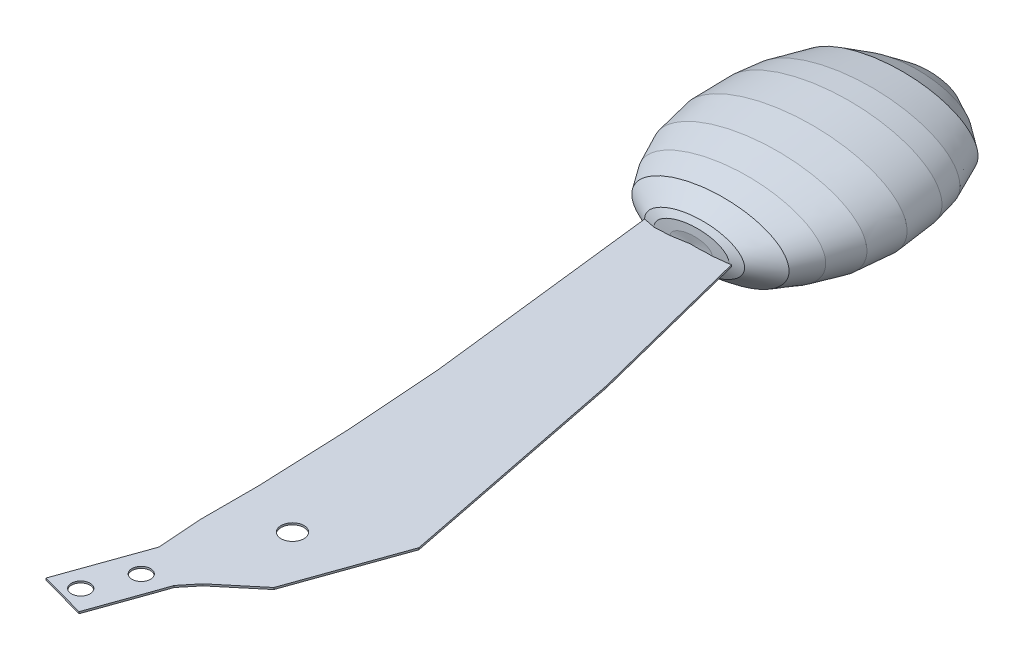
from build123d import *

# Parameters (mm, degrees)
SKETCH1_R           = 19.939448617
SKETCH1_R_2         = 16.176454633
BOSS_EXTRUDE1_DEPTH = 3.175
SCALE1_SCALE        = 0.15586
SCALE2_SCALE        = 0.15586
SCALE3_SCALE_X      = 1
SCALE3_SCALE_Y      = 0.5
SCALE3_SCALE_Z      = 1


with BuildPart() as part:
    # Sketch1 → Boss-Extrude1 (new body)
    with BuildSketch(Plane(origin=(0, 0, 0), x_dir=(1, 0, 0), z_dir=(0, 1, 0))):
        Polygon((242.554669573, -1562.560901409), (294.201688912, -1417.434682862), (288.641689889, -1339.119176599), (288.641689889, -1238.653258513), (282.160017755, -1078.231873183), (270.069009162, -907.923667127), (220.446321895, -481.557344074), (245.257665529, -490.387119681), (285.400853822, -496.622478396), (319.311265883, -496.622478396), (346.098881738, -493.504799038), (365.448239744, -485.972231877), (440.773911354, -783.801601409), (485.04619474, -1006.738758639), (521.788189636, -1191.756455194), (455.409924896, -1378.27692973), (388.054065596, -1434.408871017), (365.448239744, -1462.048779084), (355.773560741, -1489.997792136), (322.11681331, -1584.57201047), align=None)
        with Locations(Location((388.054065596, -1278.358636778, 0), (0, 0, 270))):
            Circle(SKETCH1_R, mode=Mode.SUBTRACT)
        with Locations(Location((288.641689889, -1548.088077201, 0), (0, 0, 270))):
            Circle(SKETCH1_R_2, mode=Mode.SUBTRACT)
        with Locations(Location((319.311265883, -1473.326112736, 0), (0, 0, 270))):
            Circle(SKETCH1_R_2, mode=Mode.SUBTRACT)
    extrude(amount=BOSS_EXTRUDE1_DEPTH)


with BuildPart() as part_1:
    # Scale1: scaled about (361.629635967, 1.5875, 1004.945275464)
    add(part.part.scale(SCALE1_SCALE).moved(Location((305.266040905, 1.34007225, 848.31450483))))


with BuildPart() as body_2:
    # Sketch2 → Revolve1 (revolve)
    with BuildSketch(Plane(origin=(0, 1.83492775, 0), x_dir=(1, 0, 0), z_dir=(0, 1, 0))):
        Polygon((285.400853822, -496.622478396), (248.408801058, -53.812239209), (308.769167065, -53.812239209), (355.526281419, -80.655160309), (400.414270247, -114.040049216), (429.912599709, -175.090219442), (442.151686888, -218.578324695), (451.853562795, -289.186421579), (447.002624842, -354.278857647), (429.912599709, -408.991550982), (409.051607125, -452.066593206), (365.448239744, -485.972231877), (346.098881738, -493.504799038), (319.311265883, -496.622478396), align=None)
    revolve(axis=Axis((285.400853822, 1.83492775, 496.622478396), (-0.08324930390012676, 0, -0.9965287519184504)))


with BuildPart() as body_2_1:
    # Scale2: scaled about (267.446196497, 1.83492775, 281.697771317)
    add(body_2.part.scale(SCALE2_SCALE).moved(Location((225.762032311, 1.548935911, 237.79235668))))


with BuildPart() as body_2_2:
    # Body-Move/Copy1: moved
    add(body_2_1.part.moved(Location((84.615276068, 0, 610.244292605))))


with BuildPart() as body_2_3:
    # Body-Move/Copy2: moved
    add(body_2_2.part.moved(Location((-2.369619837, 0, -1.409037308))))


with BuildPart() as body_2_4:
    # Scale3: scaled about (349.691852728, 1.83492775, 890.533026614)
    add(body_2_3.part.scale((SCALE3_SCALE_X, SCALE3_SCALE_Y, SCALE3_SCALE_Z), about=(349.691852728, 1.83492775, 890.533026614)))


with BuildPart() as body_2_5:
    # Body-Move/Copy3: moved
    add(body_2_4.part.moved(Location((0, 0, 1.591190688))))


solid = Compound([part_1.part, body_2_5.part])
